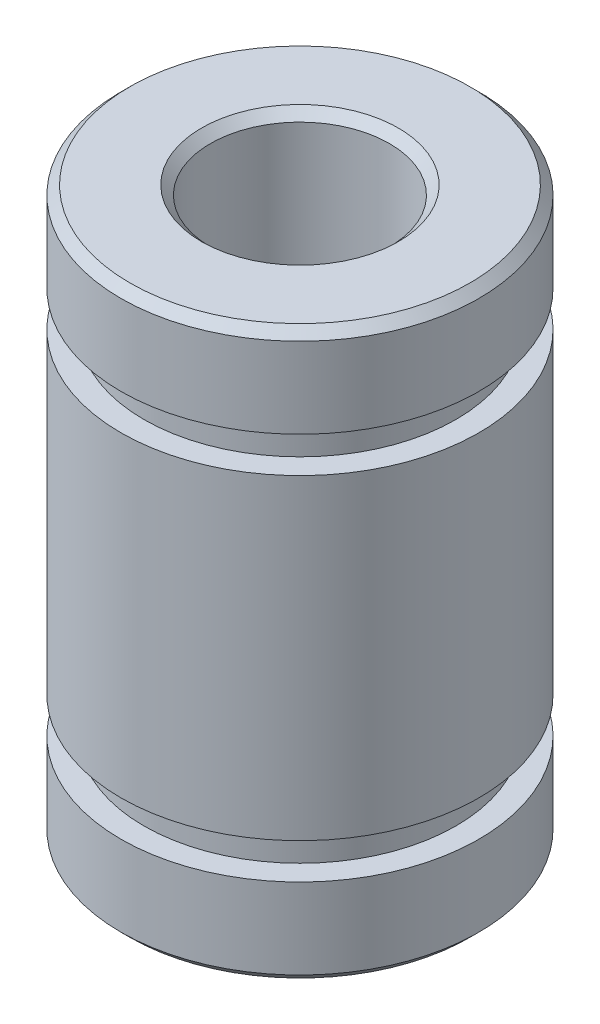
from build123d import *

# Parameters (mm, degrees)
SKETCH1_R           = 6
SKETCH1_R_2         = 3
BOSS_EXTRUDE1_DEPTH = 9.5
SKETCH2_W           = 0.770034963
SKETCH2_H           = 1.2
CHAMFER1_SIZE       = 0.3


with BuildPart() as part:
    # Sketch1 → Boss-Extrude1 (new, symmetric)
    with BuildSketch(Plane(origin=(0, 0, 0), x_dir=(1, 0, 0), z_dir=(0, 1, 0))):
        with Locations(Location((0, 0, 0), (0, 0, 270))):
            Circle(SKETCH1_R)
        with Locations(Location((0, 0, 0), (0, 0, 270))):
            Circle(SKETCH1_R_2, mode=Mode.SUBTRACT)
    extrude(amount=BOSS_EXTRUDE1_DEPTH, both=True)

    # Sketch2 → Cut-Revolve1 (revolve, cut)
    with BuildSketch(Plane(origin=(0, 0, 0), x_dir=(0, 0, -1), z_dir=(1, 0, 0)), mode=Mode.PRIVATE) as cut_revolve1_sk:
        with Locations((5.614982518, 5.9)):
            Rectangle(SKETCH2_W, SKETCH2_H)
        with Locations((5.614982518, -5.9)):
            Rectangle(SKETCH2_W, SKETCH2_H)
    revolve(cut_revolve1_sk.sketch.rotate(Axis((0, 9.5, 0), (0, -1, 0)), 180), axis=Axis((0, 9.5, 0), (0, -1, 0)), mode=Mode.SUBTRACT)

    # Chamfer1
    chamfer1_edges = [part.edges().sort_by_distance(p)[0] for p in [
        (0, -9.5, -6),
        (0, 9.5, -6),
        (0, -9.5, -3),
        (0, 9.5, -3),
    ]]
    chamfer(chamfer1_edges, length=CHAMFER1_SIZE)


solid = part.part
